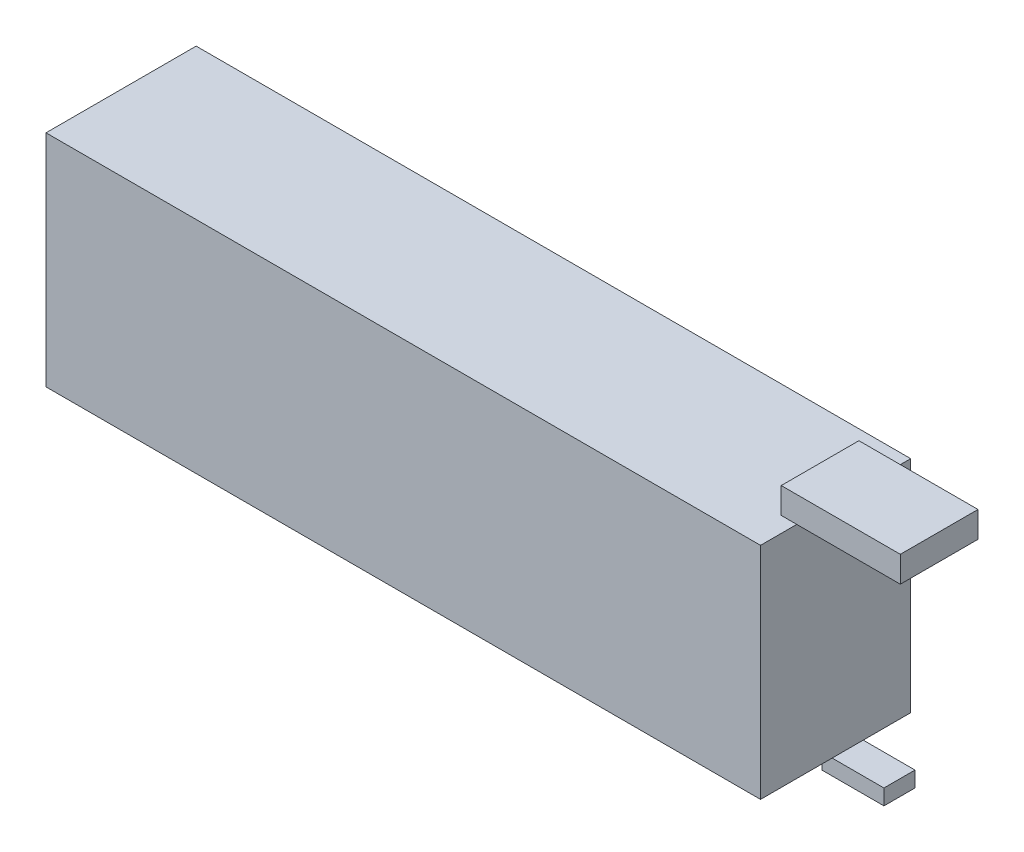
from build123d import *

# Parameters (mm, degrees)
SKETCH1_W                = 138
SKETCH1_H                = 42.5
BOSS_EXTRUDE1_DEPTH      = 14.5
BOSS_EXTRUDE2_DEPTH      = 20
BOSS_EXTRUDE2_DEPTH_BACK = 3
BOSS_EXTRUDE2_START      = 69
SKETCH2_W                = 15
SKETCH2_H                = 5
BOSS_EXTRUDE3_DEPTH      = 10
BOSS_EXTRUDE3_DEPTH_BACK = 2
BOSS_EXTRUDE3_START      = 69
SKETCH2_3_W              = 6
SKETCH2_3_H              = 3


with BuildPart() as part:
    # Sketch1 → Boss-Extrude1 (new, symmetric)
    with BuildSketch(Plane.XY):
        Rectangle(SKETCH1_W, SKETCH1_H)
    extrude(amount=BOSS_EXTRUDE1_DEPTH, both=True)

    # Sketch2 → Boss-Extrude2 (add, two sides: drawn at the far end of the back side and taken through both)
    with BuildSketch(Plane(origin=(0, 0, 0), x_dir=(0, 0, -1), z_dir=(1, 0, 0)).offset(BOSS_EXTRUDE2_START - BOSS_EXTRUDE2_DEPTH_BACK)):
        with Locations((0, 23.75)):
            Rectangle(SKETCH2_W, SKETCH2_H)
    extrude(amount=BOSS_EXTRUDE2_DEPTH + BOSS_EXTRUDE2_DEPTH_BACK)

    # Sketch2<3> → Boss-Extrude3 (add, two sides: drawn at the far end of the back side and taken through both)
    with BuildSketch(Plane(origin=(0, 0, 0), x_dir=(0, 0, -1), z_dir=(1, 0, 0)).offset(BOSS_EXTRUDE3_START - BOSS_EXTRUDE3_DEPTH_BACK)):
        with Locations((2.334145167, -22.75)):
            Rectangle(SKETCH2_3_W, SKETCH2_3_H)
    extrude(amount=BOSS_EXTRUDE3_DEPTH + BOSS_EXTRUDE3_DEPTH_BACK)


solid = part.part
